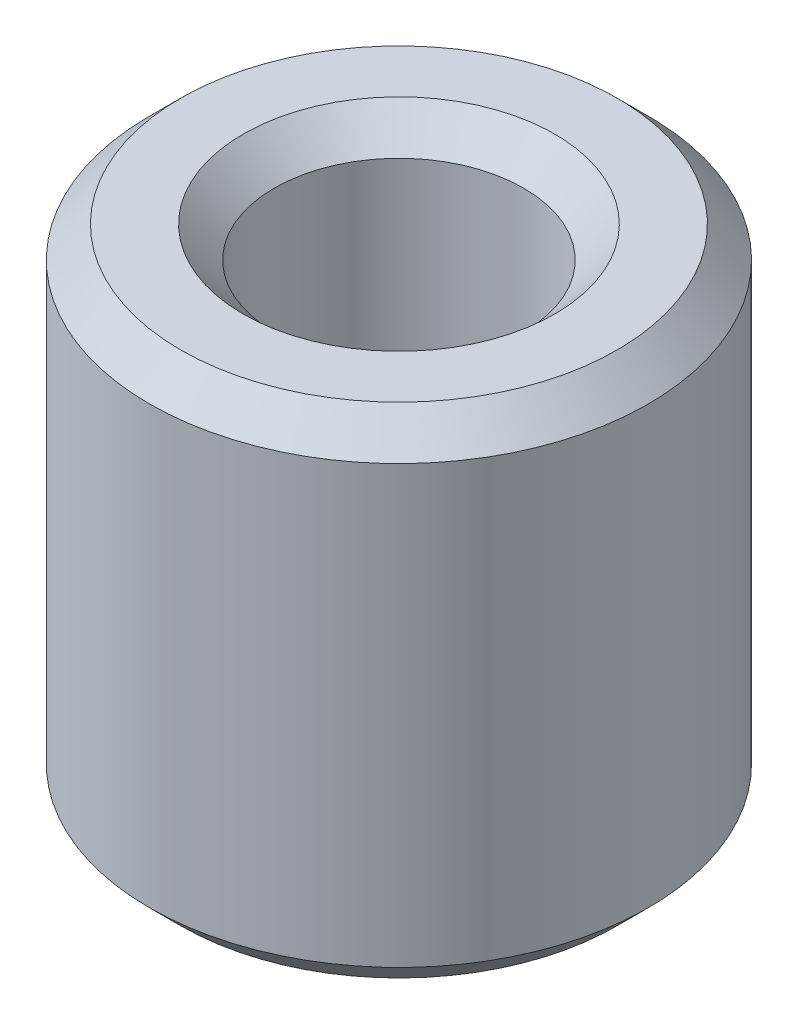
from build123d import *

# Parameters (mm, degrees)
CROQUIS1_R              = 4
CROQUIS1_R_2            = 2
SALIENTE_EXTRUIR1_DEPTH = 8
CHAFL_N1_SIZE           = 0.5


with BuildPart() as part:
    # Croquis1 → Saliente-Extruir1 (new body)
    with BuildSketch(Plane(origin=(0, 0, 0), x_dir=(1, 0, 0), z_dir=(0, 1, 0))):
        with Locations(Location((0, 0, 0), (0, 0, 270))):
            Circle(CROQUIS1_R)
        with Locations(Location((0, 0, 0), (0, 0, 270))):
            Circle(CROQUIS1_R_2, mode=Mode.SUBTRACT)
    extrude(amount=SALIENTE_EXTRUIR1_DEPTH)

    # Chaflán1
    chafl_n1_edges = [part.edges().sort_by_distance(p)[0] for p in [
        (0, 0, -4),
        (0, 8, -4),
        (0, 0, -2),
        (0, 8, -2),
    ]]
    chamfer(chafl_n1_edges, length=CHAFL_N1_SIZE)


solid = part.part
